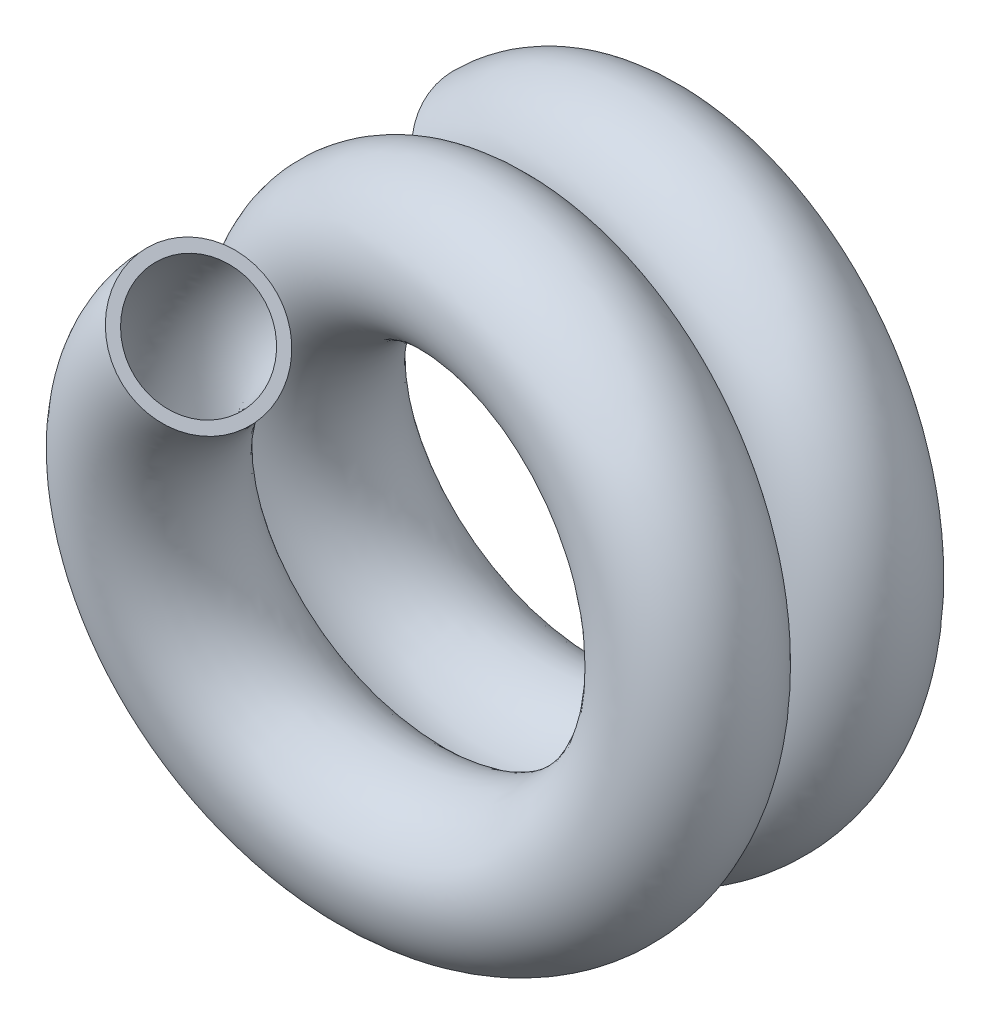
from build123d import *

# Parameters (mm, degrees)
SWEEP1_PITCH       = 50.8
SWEEP1_HEIGHT      = 101.6
SWEEP1_RADIUS      = 76.2
SWEEP1_START_ANGLE = 135
SKETCH3_R          = 24.13
SKETCH3_R_2        = 20.193


with BuildPart() as part:
    # Sweep1: sweep along a helix
    with BuildLine() as sweep1_path:
        add(Helix(SWEEP1_PITCH, SWEEP1_HEIGHT, SWEEP1_RADIUS, center=(0, 0, 0), direction=(0, 0, 1), lefthand=True, mode=Mode.PRIVATE).rotate(Axis((0, 0, 0), (0, 0, 1)), SWEEP1_START_ANGLE))
    # Sketch3 → Sweep1 (sweep)
    with BuildSketch(Plane(origin=(-53.881536726, 53.881536726, 0), x_dir=(0.7098102339396402, -0.6854853936630503, -0.1621086267573884), z_dir=(0.7031598041267358, 0.7031598041267426, 0.10551104075352251))):
        Circle(SKETCH3_R)
        Circle(SKETCH3_R_2, mode=Mode.SUBTRACT)
    sweep(path=sweep1_path.line, is_frenet=True)


solid = part.part
